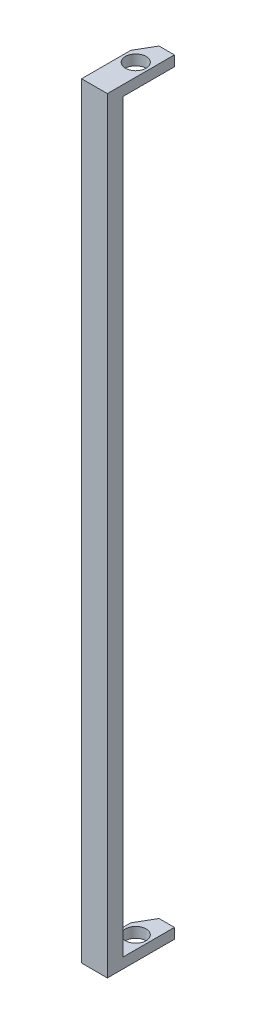
from build123d import *

# Parameters (mm, degrees)
ESQUISSE1_R        = 2
BOSS_EXTRU_1_DEPTH = 2
ESQUISSE2_W        = 5
ESQUISSE2_H        = 3
BOSS_EXTRU_2_DEPTH = 144.52
ESQUISSE3_R        = 2
BOSS_EXTRU_3_DEPTH = 2


with BuildPart() as part:
    # Esquisse1 → Boss.-Extru.1 (new body)
    with BuildSketch(Plane(origin=(0, 0, 0), x_dir=(1, 0, 0), z_dir=(0, 1, 0))):
        Polygon((2.01, 10), (0, 6.52), (0, 0), (0, -3), (5, -3), (5, 0), (5, 10), align=None)
        with Locations(Location((2.5, 5, 0), (0, 0, 270))):
            Circle(ESQUISSE1_R, mode=Mode.SUBTRACT)
    extrude(amount=BOSS_EXTRU_1_DEPTH)

    # Esquisse2 → Boss.-Extru.2 (add)
    with BuildSketch(Plane(origin=(0, 2, 0), x_dir=(1, 0, 0), z_dir=(0, 1, 0))):
        with Locations((2.5, -1.5)):
            Rectangle(ESQUISSE2_W, ESQUISSE2_H)
    extrude(amount=BOSS_EXTRU_2_DEPTH)

    # Esquisse3 → Boss.-Extru.3 (add)
    with BuildSketch(Plane(origin=(0, 146.52, 0), x_dir=(1, 0, 0), z_dir=(0, 1, 0))):
        Polygon((2.01, 10), (0, 6.52), (0, -3), (5, -3), (5, 10), align=None)
        with Locations(Location((2.5, 5, 0), (0, 0, 270))):
            Circle(ESQUISSE3_R, mode=Mode.SUBTRACT)
    extrude(amount=BOSS_EXTRU_3_DEPTH)


solid = part.part
